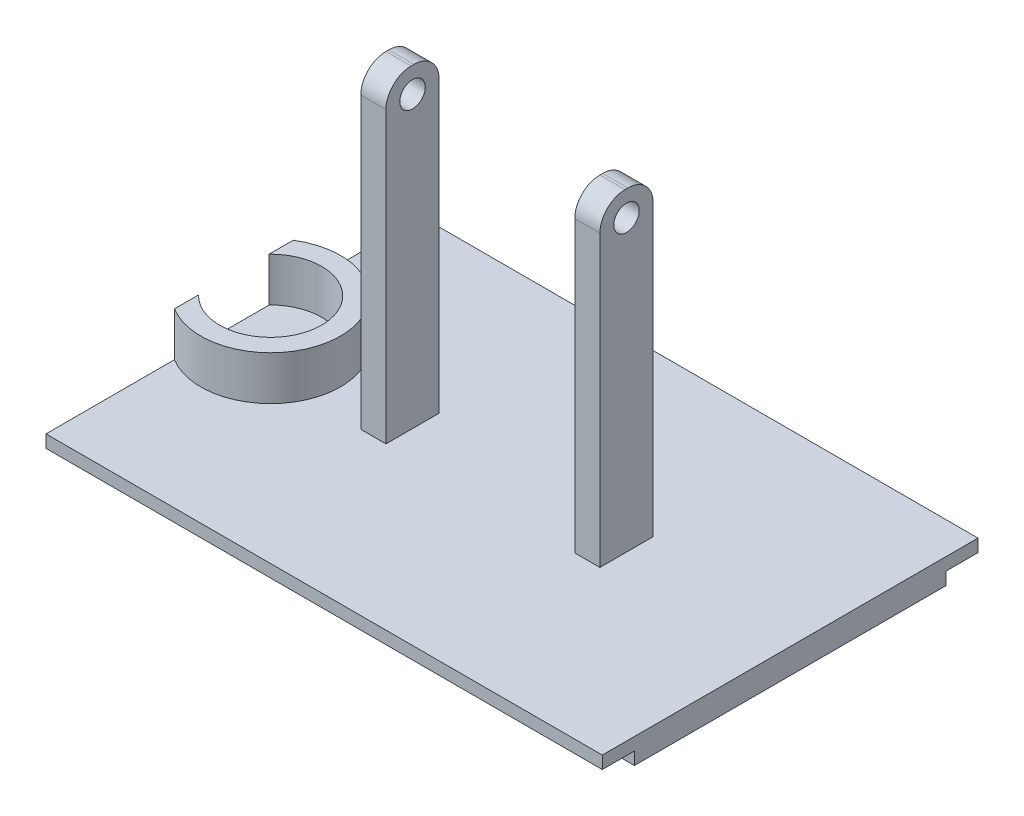
from build123d import *

# Parameters (mm, degrees)
IZIM2_W                     = 88.39
IZIM2_H                     = 59.7
Y_KSEKLIK_EKSTR_ZYON1_DEPTH = 4
Y_KSEKLIK_EKSTR_ZYON2_DEPTH = 7
Y_KSEKLIK_EKSTR_ZYON3_DEPTH = 4
RADYUS2_R                   = 4
IZIM6_R                     = 2.025
KES_EKSTR_ZYON1_DEPTH       = 4
RADYUS2_OF_AYNALAMA1_R      = 4
IZIM10_W                    = 5.1
IZIM10_H                    = 2
KES_EKSTR_ZYON2_DEPTH       = 88.39


with BuildPart() as part:
    # Çizim2 → Yükseklik-Ekstrüzyon1 (new body)
    with BuildSketch(Plane(origin=(0, 0, 0), x_dir=(1, 0, 0), z_dir=(0, 1, 0))):
        with Locations((5.778877035, -29.85)):
            Rectangle(IZIM2_W, IZIM2_H)
    extrude(amount=Y_KSEKLIK_EKSTR_ZYON1_DEPTH)

    # Çizim3 → Yükseklik-Ekstrüzyon2 (add)
    with BuildSketch(Plane(origin=(0, 4, 0), x_dir=(1, 0, 0), z_dir=(0, 1, 0))):
        with BuildLine():
            ThreePointArc((-38.416122965, -39.288399656), (-21.474324276, -29.85), (-38.416122965, -20.411600344))
            Line((-38.416122965, -20.411600344), (-38.416122965, -24.238994023))
            ThreePointArc((-38.416122965, -24.238994023), (-24.474324276, -29.85), (-38.416122965, -35.461005977))
            Line((-38.416122965, -35.461005977), (-38.416122965, -39.288399656))
        make_face()
    extrude(amount=Y_KSEKLIK_EKSTR_ZYON2_DEPTH)

    # Çizim5 → Yükseklik-Ekstrüzyon3 (add)
    with BuildSketch(Plane(origin=(19.973877035, 0, 0), x_dir=(0, 0, -1), z_dir=(1, 0, 0))):
        Polygon((-32.003216554, 4), (-27.696783446, 4), (-25.626729832, 4), (-25.626729832, 54), (-34.073270168, 54), (-34.073270168, 4), align=None)
    y_kseklik_ekstr_zyon3 = extrude(amount=Y_KSEKLIK_EKSTR_ZYON3_DEPTH)

    # Radyus2
    radyus2_edges = [part.edges().sort_by_distance(p)[0] for p in [
        (21.973877035, 54, 25.626729832),
        (21.973877035, 54, 34.073270168),
    ]]
    fillet(radyus2_edges, radius=RADYUS2_R)

    # Çizim6 → Kes-Ekstrüzyon1 (cut)
    with BuildSketch(Plane(origin=(23.973877035, 0, 0), x_dir=(0, 0, -1), z_dir=(1, 0, 0))):
        with Locations((-29.85, 50)):
            Circle(IZIM6_R)
    kes_ekstr_zyon1 = extrude(amount=-KES_EKSTR_ZYON1_DEPTH, mode=Mode.SUBTRACT)

    # Aynalama1: Yükseklik-Ekstrüzyon3, Kes-Ekstrüzyon1 across plane
    add(y_kseklik_ekstr_zyon3.mirror(Plane(origin=(4.973877035, 0, 0), x_dir=(0, 0, 1), z_dir=(1, 0, 0))))
    add(kes_ekstr_zyon1.mirror(Plane(origin=(4.973877035, 0, 0), x_dir=(0, 0, 1), z_dir=(1, 0, 0))), mode=Mode.SUBTRACT)

    # Radyus2 of Aynalama1
    radyus2_of_aynalama1_edges = [part.edges().sort_by_distance(p)[0] for p in [
        (-12.026122965, 54, 25.626729832),
        (-12.026122965, 54, 34.073270168),
    ]]
    fillet(radyus2_of_aynalama1_edges, radius=RADYUS2_OF_AYNALAMA1_R)

    # Çizim10 → Kes-Ekstrüzyon2 (cut)
    with BuildSketch(Plane.ZY.offset(38.416122965)):
        with Locations((2.55, 1)):
            Rectangle(IZIM10_W, IZIM10_H)
        with Locations((57.15, 1)):
            Rectangle(IZIM10_W, IZIM10_H)
    extrude(amount=-KES_EKSTR_ZYON2_DEPTH, mode=Mode.SUBTRACT)


solid = part.part
